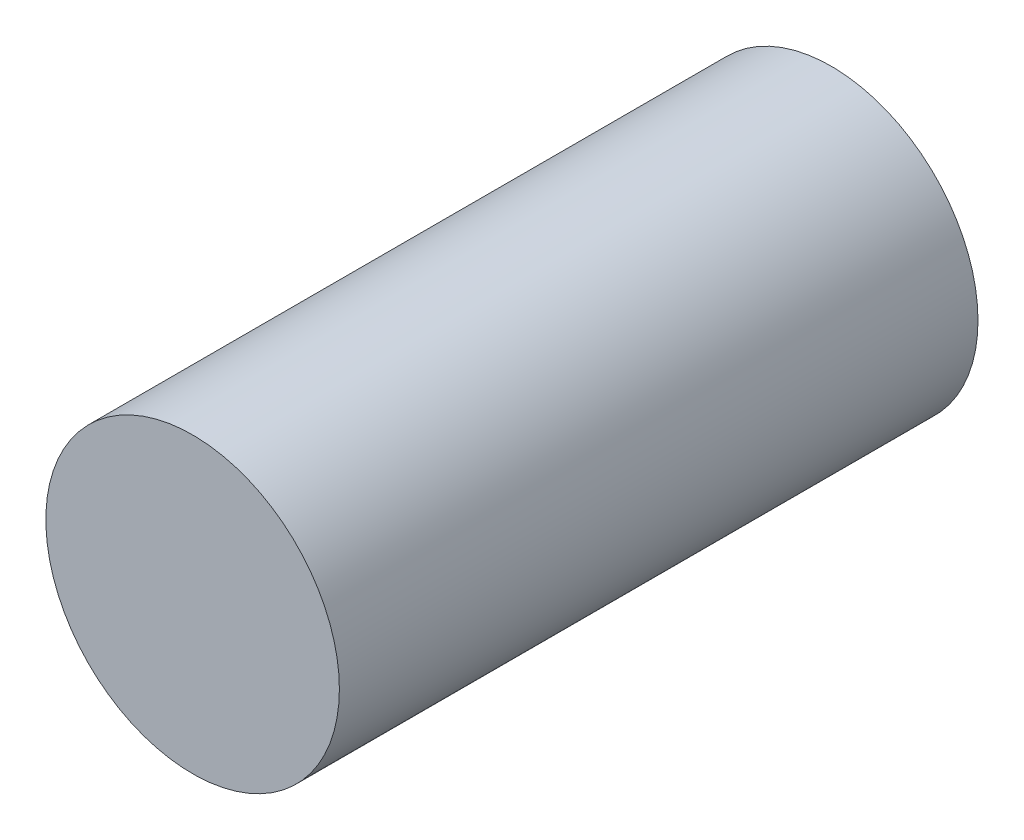
from build123d import *

# Parameters (mm, degrees)
SKETCH_1_R      = 113.3
EXTRUDE_1_DEPTH = 493


with BuildPart() as part:
    # 草圖1 → 填料-伸長1 (new body)
    with BuildSketch(Plane.XY):
        Circle(SKETCH_1_R)
    extrude(amount=EXTRUDE_1_DEPTH)


solid = part.part
